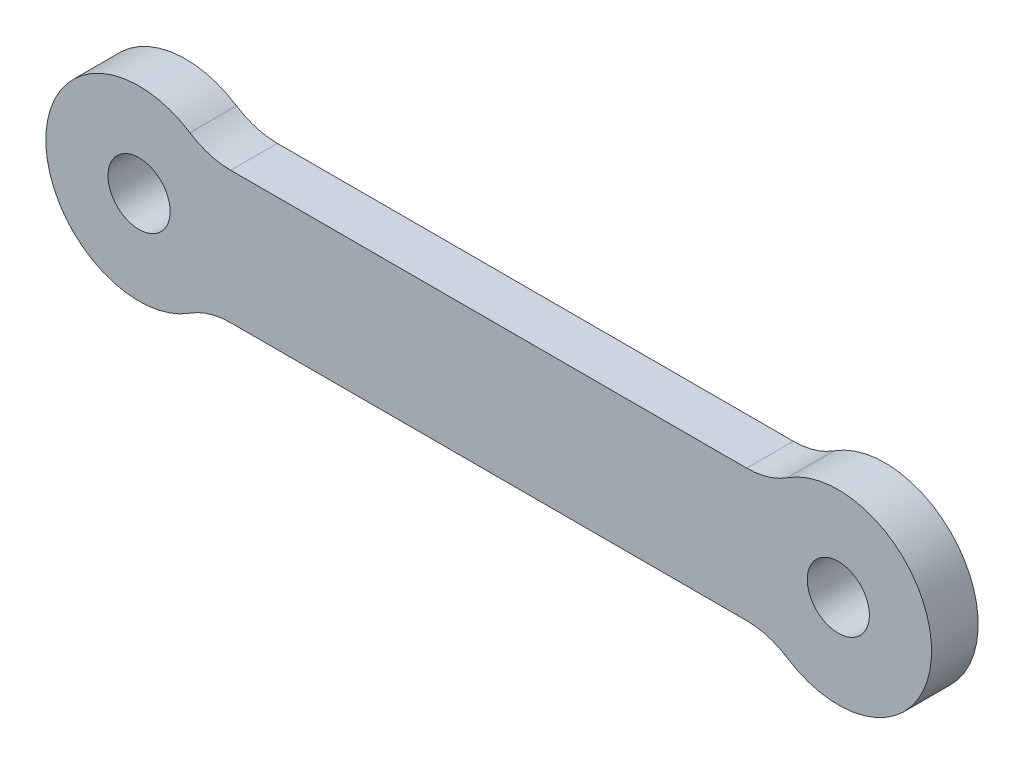
from build123d import *

# Parameters (mm, degrees)
SKETCH_1_R      = 2
EXTRUDE_1_DEPTH = 3


with BuildPart() as part:
    # 草图1 → 凸台-拉伸1 (new body)
    with BuildSketch(Plane.XY):
        with BuildLine():
            Line((5.898358373, 4.25), (39.101641627, 4.25))
            ThreePointArc((39.101641627, 4.25), (40.471260422, 4.448893293), (41.727733719, 5.029142411))
            ThreePointArc((41.727733719, 5.029142411), (51, 0), (41.727733719, -5.029142411))
            ThreePointArc((41.727733719, -5.029142411), (40.471260422, -4.448893293), (39.101641627, -4.25))
            Line((39.101641627, -4.25), (5.898358373, -4.25))
            ThreePointArc((5.898358373, -4.25), (4.528739578, -4.448893293), (3.272266281, -5.029142411))
            ThreePointArc((3.272266281, -5.029142411), (-6, 0), (3.272266281, 5.029142411))
            ThreePointArc((3.272266281, 5.029142411), (4.528739578, 4.448893293), (5.898358373, 4.25))
        make_face()
        Circle(SKETCH_1_R, mode=Mode.SUBTRACT)
        with Locations((45, 0)):
            Circle(SKETCH_1_R, mode=Mode.SUBTRACT)
    extrude(amount=EXTRUDE_1_DEPTH)


solid = part.part
